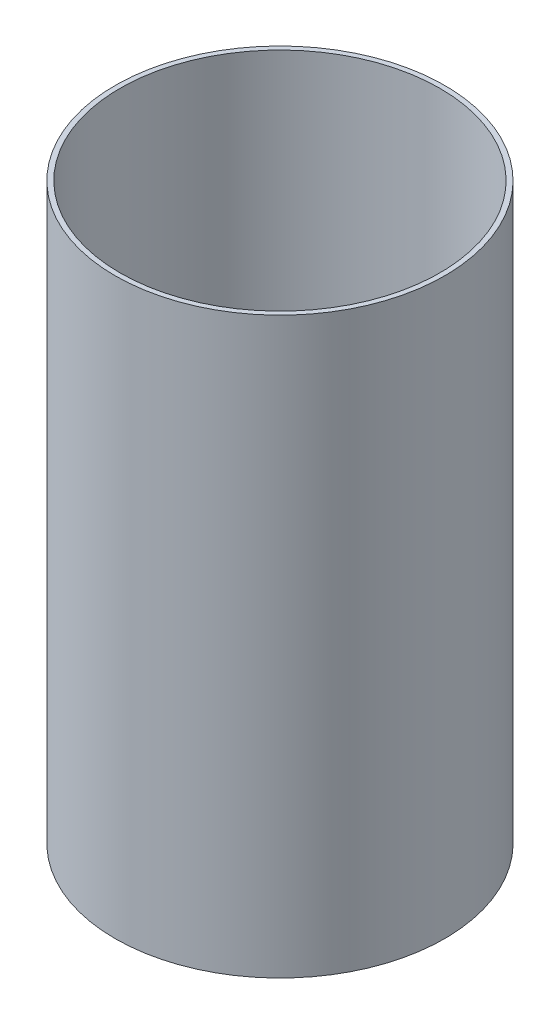
from build123d import *

# Parameters (mm, degrees)
SKETCH1_R   = 51.054
SKETCH1_R_2 = 49.53
TUBE_DEPTH  = 177.8


with BuildPart() as part:
    # Sketch1 → Tube (new body)
    with BuildSketch(Plane(origin=(0, 0, 0), x_dir=(1, 0, 0), z_dir=(0, 1, 0))):
        Circle(SKETCH1_R)
        Circle(SKETCH1_R_2, mode=Mode.SUBTRACT)
    extrude(amount=TUBE_DEPTH)


solid = part.part
